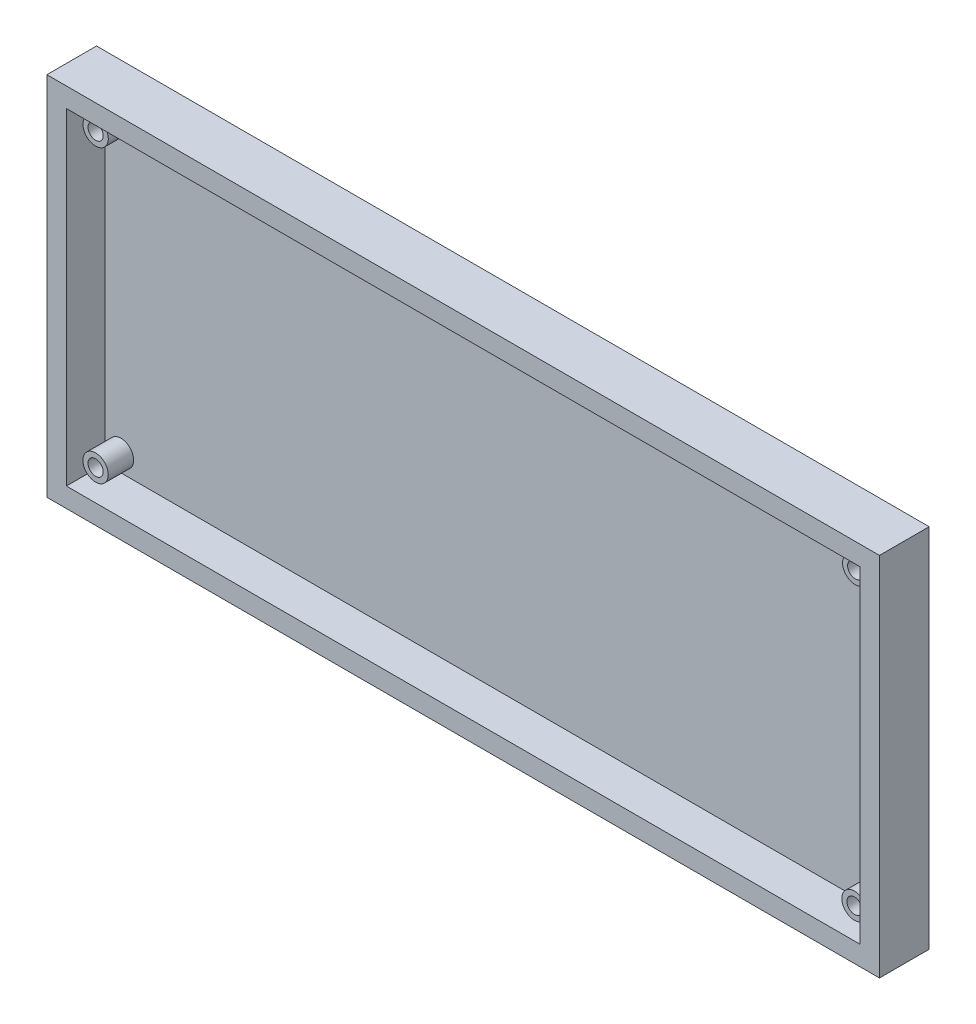
from build123d import *

# Parameters (mm, degrees)
BOSS_EXTRUDE1_DEPTH      = 2.54
BOSS_EXTRUDE1_DEPTH_BACK = 8.89
SKETCH1_W                = 191.555456122
SKETCH1_H                = 84.203656122
SKETCH1_W_2              = 182.5752
SKETCH1_H_2              = 75.2234
SKETCH3_W                = 182.5752
SKETCH3_H                = 75.2234
BOSS_EXTRUDE4_DEPTH      = 2.54
SKETCH4_R                = 2.9150268
SKETCH4_R_2              = 1.75
BOSS_EXTRUDE6_DEPTH      = 5.842


with BuildPart() as part:
    # Sketch1 → Boss-Extrude1 (new, two sides: drawn at the far end of the back side and taken through both)
    with BuildSketch(Plane.XY.offset(-BOSS_EXTRUDE1_DEPTH_BACK)):
        with Locations((87.6132, 33.6117)):
            Rectangle(SKETCH1_W, SKETCH1_H)
        with Locations((87.6132, 33.6117)):
            Rectangle(SKETCH1_W_2, SKETCH1_H_2, mode=Mode.SUBTRACT)
    extrude(amount=BOSS_EXTRUDE1_DEPTH + BOSS_EXTRUDE1_DEPTH_BACK)

    # Sketch3 → Boss-Extrude4 (add)
    with BuildSketch(Plane(origin=(0, 0, -8.89), x_dir=(-1, 0, 0), z_dir=(0, 0, -1))):
        with Locations((-87.6132, 33.6117)):
            Rectangle(SKETCH3_W, SKETCH3_H)
    extrude(amount=-BOSS_EXTRUDE4_DEPTH)

    # Sketch4 → Boss-Extrude6 (add)
    # profile 1 of 4: a face of its own
    with BuildSketch(Plane.XY.offset(-6.35)):
        with Locations(Location((0.0086, 66.9562, 0), (0, 0, 180))):
            Circle(SKETCH4_R)
        with Locations((0.0086, 66.9562)):
            Circle(SKETCH4_R_2, mode=Mode.SUBTRACT)
    # profile 2 of 4: a face of its own
    with BuildSketch(Plane.XY.offset(-6.35)):
        with Locations(Location((174.7606, 66.9562, 0), (0, 0, 180))):
            Circle(SKETCH4_R)
        with Locations((174.7606, 66.9562)):
            Circle(SKETCH4_R_2, mode=Mode.SUBTRACT)
    # profile 3 of 4: a face of its own
    with BuildSketch(Plane.XY.offset(-6.35)):
        with Locations(Location((174.6, 0, 0), (0, 0, 180))):
            Circle(SKETCH4_R)
        with Locations((174.6, 0)):
            Circle(SKETCH4_R_2, mode=Mode.SUBTRACT)
    # profile 4 of 4: a face of its own
    with BuildSketch(Plane.XY.offset(-6.35)):
        with Locations(Location((0, 0, 0), (0, 0, 180))):
            Circle(SKETCH4_R)
        Circle(SKETCH4_R_2, mode=Mode.SUBTRACT)
    extrude(amount=BOSS_EXTRUDE6_DEPTH)


solid = part.part
